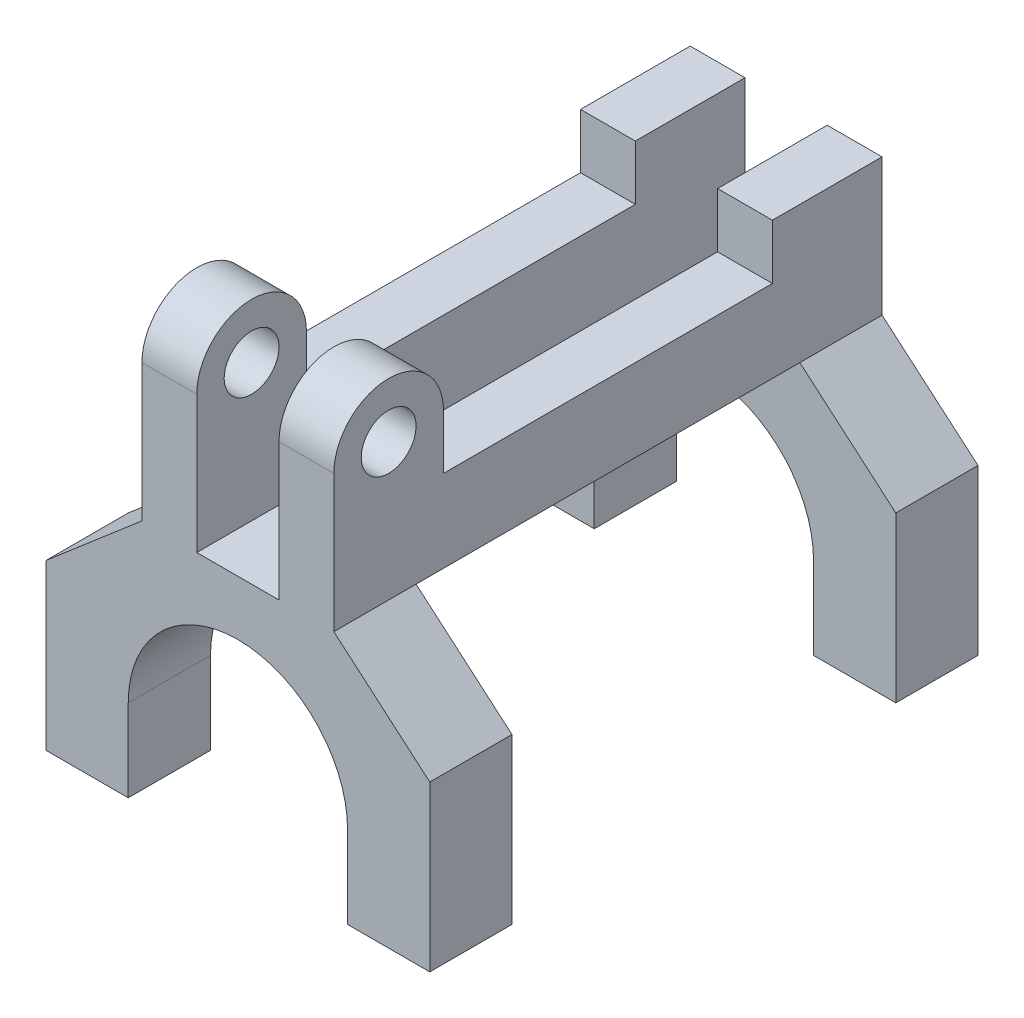
from build123d import *

# Parameters (mm, degrees)
BOSS_EXTRUDE1_DEPTH = 127
SKETCH2_W           = 88.9
SKETCH2_H           = 57.15
CUT_EXTRUDE1_DEPTH  = 88.9
SKETCH3_R           = 6.35
BOSS_EXTRUDE2_DEPTH = 44.45
SKETCH4_W           = 19.05
SKETCH4_H           = 44.45
CUT_EXTRUDE2_DEPTH  = 127


with BuildPart() as part:
    # Sketch1 → Boss-Extrude1 (new body)
    with BuildSketch(Plane.XY):
        with BuildLine():
            Line((-44.45, -21.039739617), (-44.45, -59.139739617))
            Line((-44.45, -59.139739617), (-25.4, -59.139739617))
            Line((-25.4, -59.139739617), (-25.4, -40.089739617))
            ThreePointArc((-25.4, -40.089739617), (0, -14.689739617), (25.4, -40.089739617))
            Line((25.4, -40.089739617), (25.4, -59.139739617))
            Line((25.4, -59.139739617), (44.45, -59.139739617))
            Line((44.45, -59.139739617), (44.45, -21.039739617))
            Line((44.45, -21.039739617), (22.225, -1.989739617))
            Line((22.225, -1.989739617), (-22.225, -1.989739617))
            Line((-22.225, -1.989739617), (-44.45, -21.039739617))
        make_face()
    extrude(amount=-BOSS_EXTRUDE1_DEPTH)

    # Sketch2 → Cut-Extrude1 (cut)
    with BuildSketch(Plane(origin=(44.45, 0, 0), x_dir=(0, 0, -1), z_dir=(1, 0, 0))):
        with Locations((63.5, -30.564739617)):
            Rectangle(SKETCH2_W, SKETCH2_H)
    extrude(amount=-CUT_EXTRUDE1_DEPTH, mode=Mode.SUBTRACT)


with BuildPart() as cut_extrude1_piece_1:
    # of the separate pieces the step leaves, piece 1, a body of its own (cut_extrude1_pieces)
    add(part.part.solids().sort_by_distance((-44.45, -21.039739617, 0))[0])

    # Sketch3 → Boss-Extrude2 (add)
    with BuildSketch(Plane.ZY.offset(-22.225)):
        with BuildLine():
            Line((0, -1.989739617), (0, 29.760261325))
            ThreePointArc((0, 29.760261325), (-12.700000942, 42.460260383), (-25.4, 29.760259441))
            Line((-25.4, 29.760259441), (-25.4, 17.060260383))
            Line((-25.4, 17.060260383), (-101.6, 17.060260383))
            Line((-101.6, 17.060260383), (-101.6, 29.760260383))
            Line((-101.6, 29.760260383), (-127, 29.760260383))
            Line((-127, 29.760260383), (-127, -1.989739617))
            Line((-127, -1.989739617), (0, -1.989739617))
        make_face()
        with Locations((-12.7, 29.760260383)):
            Circle(SKETCH3_R, mode=Mode.SUBTRACT)
    extrude(amount=BOSS_EXTRUDE2_DEPTH)

    # Sketch4 → Cut-Extrude2 (cut)
    with BuildSketch(Plane.XY):
        with Locations((0, 20.235260383)):
            Rectangle(SKETCH4_W, SKETCH4_H)
    extrude(amount=-CUT_EXTRUDE2_DEPTH, mode=Mode.SUBTRACT)


with BuildPart() as cut_extrude1_piece_2:
    # of the separate pieces the step leaves, piece 2, a body of its own (cut_extrude1_pieces)
    add(part.part.solids().sort_by_distance((-44.45, -21.039739617, -107.95))[0])


solid = Compound([cut_extrude1_piece_1.part, cut_extrude1_piece_2.part])
